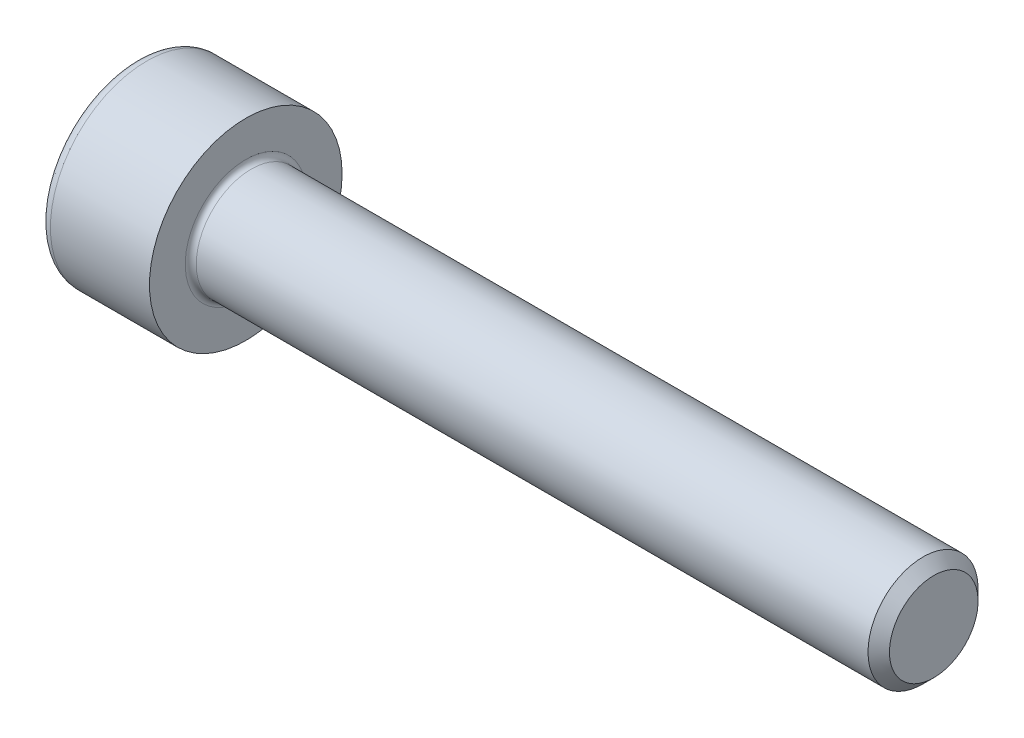
from build123d import *

# Parameters (mm, degrees)
BASEHEADSKE_R   = 3.5
BASEHEAD_DEPTH  = 4
CUTSOCKET_DEPTH = 2
FILLET1_R       = 0.2
FILLET2_R       = 0.4


with BuildPart() as part:
    # BaseHeadSke → BaseHead (new body)
    with BuildSketch(Plane(origin=(0, 0, 0), x_dir=(0, 0, -1), z_dir=(1, 0, 0))):
        Circle(BASEHEADSKE_R)
    extrude(amount=BASEHEAD_DEPTH)

    # BodySke → BaseBody (revolve)
    with BuildSketch(Plane.XY, mode=Mode.PRIVATE) as basebody_sk:
        Polygon((0, 0), (29, 0), (29, 1.61), (28.61, 2), (0, 2), align=None)
    revolve(basebody_sk.sketch.rotate(Axis((0, 0, 0), (1, 0, 0)), 90), axis=Axis((0, 0, 0), (1, 0, 0)))

    # CutSocketSke → CutSocket (cut)
    with BuildSketch(Plane(origin=(0, 0, 0), x_dir=(0, 0, -1), z_dir=(1, 0, 0))):
        Polygon((0, 1.732050808), (-1.5, 0.866025404), (-1.5, -0.866025404), (0, -1.732050808), (1.5, -0.866025404), (1.5, 0.866025404), align=None)
    extrude(amount=CUTSOCKET_DEPTH, mode=Mode.SUBTRACT)

    # CutHoleSke → CutHole (revolve, cut)
    with BuildSketch(Plane.XY, mode=Mode.PRIVATE) as cuthole_sk:
        Polygon((0, 1.5), (2.6, 1.5), (3.466025404, 0), (0, 0), align=None)
    revolve(cuthole_sk.sketch.rotate(Axis((0, 0, 0), (1, 0, 0)), 90), axis=Axis((0, 0, 0), (1, 0, 0)), mode=Mode.SUBTRACT)

    # Fillet1
    fillet1_edges = [part.edges().sort_by_distance(p)[0] for p in [
        (4, 0, -2),
    ]]
    fillet(fillet1_edges, radius=FILLET1_R)

    # Fillet2
    fillet2_edges = [part.edges().sort_by_distance(p)[0] for p in [
        (0, 0, 3.5),
    ]]
    fillet(fillet2_edges, radius=FILLET2_R)


solid = part.part
